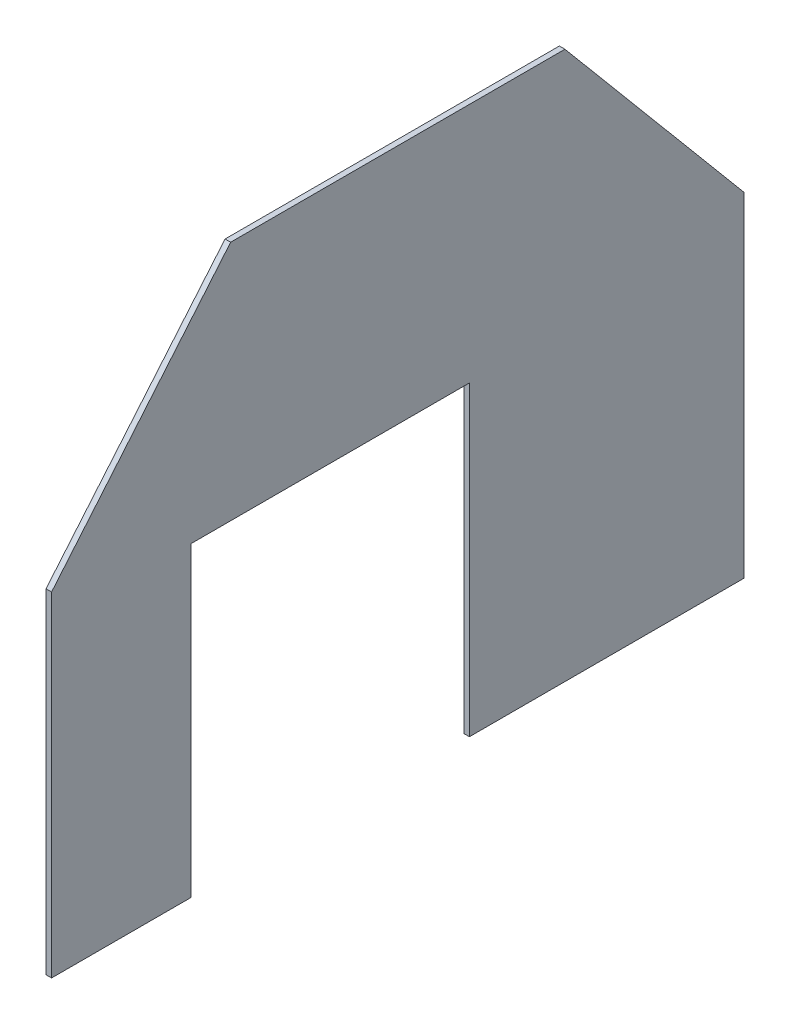
from build123d import *

# Parameters (mm, degrees)
EXTRUDE_1_DEPTH     = 1
SKETCH_2_W          = 50
SKETCH_2_H          = 55
CUT_EXTRUDE_1_DEPTH = 1


with BuildPart() as part:
    # 草图1 → 凸台-拉伸1 (new body)
    with BuildSketch(Plane(origin=(0, 0, 0), x_dir=(0, 0, -1), z_dir=(1, 0, 0))):
        Polygon((0, 0), (0, 60), (32.139380484, 98.302222156), (92.139380484, 98.302222156), (124.278760969, 60), (124.278760969, 0), align=None)
    extrude(amount=-EXTRUDE_1_DEPTH)

    # 草图2 → 切除-拉伸1 (cut)
    with BuildSketch(Plane(origin=(0, 0, 0), x_dir=(0, 0, -1), z_dir=(1, 0, 0))):
        with Locations((50, 27.5)):
            Rectangle(SKETCH_2_W, SKETCH_2_H)
    extrude(amount=-CUT_EXTRUDE_1_DEPTH, mode=Mode.SUBTRACT)


solid = part.part
